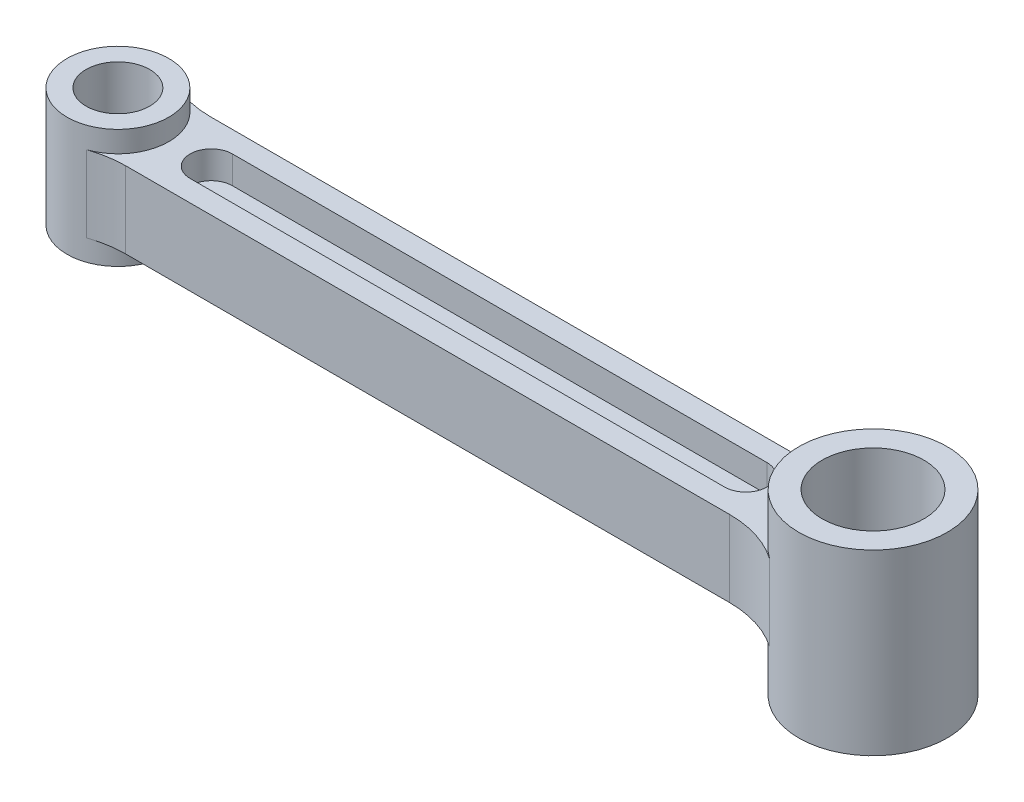
from build123d import *

# Parameters (mm, degrees)
BOSS_EXTRUDE1_DEPTH      = 21
BOSS_EXTRUDE1_DEPTH_BACK = 21
SKETCH1_R                = 12
BOSS_EXTRUDE2_DEPTH      = 9
BOSS_EXTRUDE2_DEPTH_BACK = 9
BOSS_EXTRUDE3_DEPTH      = 14
BOSS_EXTRUDE3_DEPTH_BACK = 14
SKETCH1_4_R              = 7.5
BOSS_EXTRUDE4_DEPTH      = 2.5
BOSS_EXTRUDE4_DEPTH_BACK = 2.5


with BuildPart() as part:
    # Sketch1 → Boss-Extrude1 (new, two sides: drawn at the far end of the back side and taken through both)
    with BuildSketch(Plane(origin=(0, 0, 0), x_dir=(1, 0, 0), z_dir=(0, 1, 0)).offset(-BOSS_EXTRUDE1_DEPTH_BACK)):
        with BuildLine():
            ThreePointArc((110.5, 0), (101.082293252, 15.521808393), (82.965538766, 14.337349398))
            ThreePointArc((82.965538766, 14.337349398), (75.5, 0), (82.965538766, -14.337349398))
            ThreePointArc((82.965538766, -14.337349398), (101.082293252, -15.521808393), (110.5, 0))
        make_face()
        with Locations((93, 0)):
            Circle(SKETCH1_R, mode=Mode.SUBTRACT)
    extrude(amount=BOSS_EXTRUDE1_DEPTH + BOSS_EXTRUDE1_DEPTH_BACK)

    # Sketch1<3> → Boss-Extrude2 (add, two sides: drawn at the far end of the back side and taken through both)
    with BuildSketch(Plane(origin=(0, 0, 0), x_dir=(1, 0, 0), z_dir=(0, 1, 0)).offset(-BOSS_EXTRUDE2_DEPTH_BACK)):
        with BuildLine():
            Line((69.203991931, 10), (-73.167840434, 10))
            ThreePointArc((-73.167840434, 10), (-77.167840434, 10.335680868), (-81.055946811, 11.333333333))
            ThreePointArc((-81.055946811, 11.333333333), (-75.219186172, 6.952386703), (-73, 0))
            ThreePointArc((-73, 0), (-75.219186172, -6.952386703), (-81.055946811, -11.333333333))
            ThreePointArc((-81.055946811, -11.333333333), (-77.167840434, -10.335680868), (-73.167840434, -10))
            Line((-73.167840434, -10), (69.203991931, -10))
            ThreePointArc((69.203991931, -10), (76.418435276, -11.110006395), (82.965538766, -14.337349398))
            ThreePointArc((82.965538766, -14.337349398), (75.5, 0), (82.965538766, 14.337349398))
            ThreePointArc((82.965538766, 14.337349398), (76.418435276, 11.110006395), (69.203991931, 10))
        make_face()
        with BuildLine():
            Line((63, -5), (-63, -5))
            ThreePointArc((-63, -5), (-68, 0), (-63, 5))
            Line((-63, 5), (63, 5))
            ThreePointArc((63, 5), (68, 0), (63, -5))
        make_face(mode=Mode.SUBTRACT)
    extrude(amount=BOSS_EXTRUDE2_DEPTH + BOSS_EXTRUDE2_DEPTH_BACK)

    # Sketch1<4> → Boss-Extrude3 (add, two sides: drawn at the far end of the back side and taken through both)
    with BuildSketch(Plane(origin=(0, 0, 0), x_dir=(1, 0, 0), z_dir=(0, 1, 0)).offset(-BOSS_EXTRUDE3_DEPTH_BACK)):
        with BuildLine():
            ThreePointArc((-73, 0), (-75.219186172, 6.952386703), (-81.055946811, 11.333333333))
            ThreePointArc((-81.055946811, 11.333333333), (-97, 0), (-81.055946811, -11.333333333))
            ThreePointArc((-81.055946811, -11.333333333), (-75.219186172, -6.952386703), (-73, 0))
        make_face()
        with Locations((-85, 0)):
            Circle(SKETCH1_4_R, mode=Mode.SUBTRACT)
    extrude(amount=BOSS_EXTRUDE3_DEPTH + BOSS_EXTRUDE3_DEPTH_BACK)

    # Sketch1<5> → Boss-Extrude4 (add, two sides: drawn at the far end of the back side and taken through both)
    with BuildSketch(Plane(origin=(0, 0, 0), x_dir=(1, 0, 0), z_dir=(0, 1, 0)).offset(-BOSS_EXTRUDE4_DEPTH_BACK)):
        with BuildLine():
            ThreePointArc((-63, 5), (-68, 0), (-63, -5))
            Line((-63, -5), (63, -5))
            ThreePointArc((63, -5), (68, 0), (63, 5))
            Line((63, 5), (-63, 5))
        make_face()
    extrude(amount=BOSS_EXTRUDE4_DEPTH + BOSS_EXTRUDE4_DEPTH_BACK)


solid = part.part
